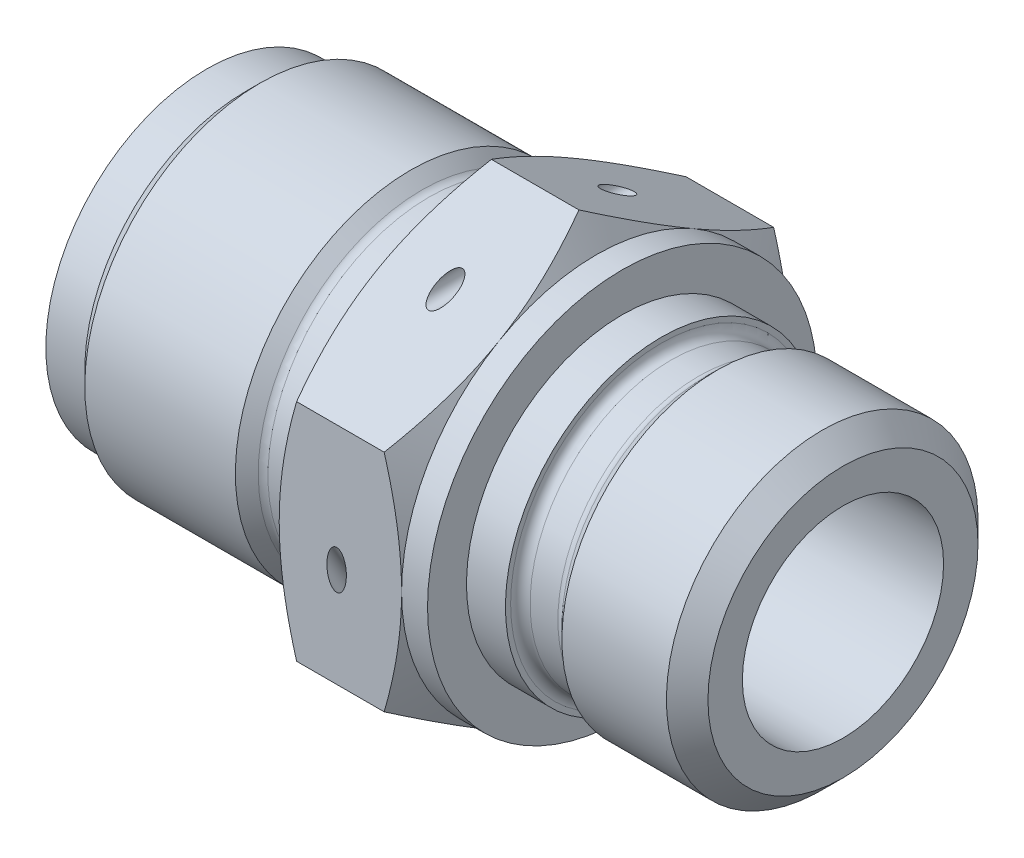
from build123d import *

# Parameters (mm, degrees)
SKETCH_2_OUTSIDE_W       = 57.368
SKETCH_2_OUTSIDE_H       = 57.368
CUT_EXTRUDE_1_DEPTH      = 41.509258201
SKETCH_3_OUTSIDE_W       = 188.496
SKETCH_3_OUTSIDE_H       = 193.138
SKETCH_3_OUTSIDE_R       = 15
CUT_EXTRUDE_2_DEPTH      = 41.174618853
CUT_EXTRUDE_2_DRAFT      = -60
SKETCH_4_OUTSIDE_W       = 177.358
SKETCH_4_OUTSIDE_H       = 182
SKETCH_4_OUTSIDE_R       = 14
CUT_EXTRUDE_3_DEPTH      = 37.959437225
CUT_EXTRUDE_3_DRAFT      = -60
SKETCH_5_R               = 0.75
CUT_EXTRUDE_4_DEPTH      = 57.824290581
PATTERN_CIRCULAR_1_COUNT = 3


with BuildPart() as part:
    # Эскиз1 → Повернуть1 (revolve)
    with BuildSketch(Plane.XY):
        with BuildLine():
            Line((0, 7.75), (-19.3, 7.75))
            Line((-19.3, 7.75), (-19.3, 3))
            Line((-19.3, 3), (-52, 3))
            Line((-52, 3), (-52, 6.75))
            Line((-52, 6.75), (-51.75, 7))
            Line((-51.75, 7), (-49, 7))
            Line((-49, 7), (-49, 12.4))
            Line((-49, 12.4), (-46, 12.4))
            Line((-46, 12.4), (-44.9, 13.5))
            Line((-44.9, 13.5), (-33.3, 13.5))
            Line((-33.3, 13.5), (-32.419669914, 12.619669914))
            ThreePointArc((-32.419669914, 12.619669914), (-32.176352402, 12.457090351), (-31.889339828, 12.4))
            Line((-31.889339828, 12.4), (-29.75, 12.4))
            ThreePointArc((-29.75, 12.4), (-29.219669914, 12.619669914), (-29, 13.15))
            Line((-29, 13.15), (-29, 20))
            Line((-29, 20), (-19, 20))
            Line((-19, 20), (-19, 15))
            Line((-19, 15), (-17, 15))
            Line((-17, 15), (-17, 12))
            Line((-17, 12), (-14, 12))
            Line((-14, 12), (-14, 11.6))
            ThreePointArc((-14, 11.6), (-13.780330086, 11.069669914), (-13.25, 10.85))
            Line((-13.25, 10.85), (-11.110660172, 10.85))
            ThreePointArc((-11.110660172, 10.85), (-10.823647598, 10.907090351), (-10.580330086, 11.069669914))
            Line((-10.580330086, 11.069669914), (-9.65, 12))
            Line((-9.65, 12), (-1.6, 12))
            Line((-1.6, 12), (0, 10.4))
            Line((0, 10.4), (0, 7.75))
        make_face()
    revolve(axis=Axis((0, 0, 0), (-1, 0, 0)))

    # Эскиз2 outside → Вырез-Вытянуть1 (cut, through all)
    with BuildSketch(Plane.ZY.offset(29)):
        Rectangle(SKETCH_2_OUTSIDE_W, SKETCH_2_OUTSIDE_H)
        Polygon((0, 17.320508076), (-15, 8.660254038), (-15, -8.660254038), (0, -17.320508076), (15, -8.660254038), (15, 8.660254038), align=None, mode=Mode.SUBTRACT)
    extrude(amount=-CUT_EXTRUDE_1_DEPTH, mode=Mode.SUBTRACT)


with BuildPart() as cut_extrude_2_tool:
    # Эскиз3 outside → Вырез-Вытянуть2 (with draft: the straight prism first)
    with BuildSketch(Plane(origin=(-19, 0, 0), x_dir=(0, 0, -1), z_dir=(1, 0, 0))):
        Rectangle(SKETCH_3_OUTSIDE_W, SKETCH_3_OUTSIDE_H)
        with Locations(Location((0, 0, 0), (0, 0, 90))):
            Circle(SKETCH_3_OUTSIDE_R, mode=Mode.SUBTRACT)
    extrude(amount=-CUT_EXTRUDE_2_DEPTH)
    # Вырез-Вытянуть2: the draft: its side faces are tilted about the plane it starts from
    cut_extrude_2_sides = [cut_extrude_2_tool.faces().sort_by_distance(p)[0] for p in [
        (-39.587309427, -96.569, 0),
        (-39.587309427, 0, -94.248),
        (-39.587309427, 96.569, 0),
        (-39.587309427, 0, 94.248),
        (-39.587309427, -15, 0),
    ]]
    draft(cut_extrude_2_sides, Plane(origin=(-19, 0, 0), x_dir=(0, 0, -1), z_dir=(1, 0, 0)), CUT_EXTRUDE_2_DRAFT)


with BuildPart() as part_1:
    add(part.part)

    # Вырез-Вытянуть2: cut by cut_extrude_2_tool
    add(cut_extrude_2_tool.part, mode=Mode.SUBTRACT)


with BuildPart() as cut_extrude_3_tool:
    # Эскиз4 outside → Вырез-Вытянуть3 (with draft: the straight prism first)
    with BuildSketch(Plane.ZY.offset(29)):
        Rectangle(SKETCH_4_OUTSIDE_W, SKETCH_4_OUTSIDE_H)
        Circle(SKETCH_4_OUTSIDE_R, mode=Mode.SUBTRACT)
    extrude(amount=-CUT_EXTRUDE_3_DEPTH)
    # Вырез-Вытянуть3: the draft: its side faces are tilted about the plane it starts from
    cut_extrude_3_sides = [cut_extrude_3_tool.faces().sort_by_distance(p)[0] for p in [
        (-10.020281387, -91, 0),
        (-10.020281387, 0, 88.679),
        (-10.020281387, 91, 0),
        (-10.020281387, 0, -88.679),
        (-10.020281387, 0, -14),
    ]]
    draft(cut_extrude_3_sides, Plane.ZY.offset(29), CUT_EXTRUDE_3_DRAFT)


with BuildPart() as part_2:
    add(part_1.part)

    # Вырез-Вытянуть3: cut by cut_extrude_3_tool
    add(cut_extrude_3_tool.part, mode=Mode.SUBTRACT)

    # Эскиз5 → Вырез-Вытянуть4 (cut, symmetric)
    with BuildSketch(Plane.XY):
        with Locations(Location((-24, 13.5, 0), (0, 0, 270))):
            Circle(SKETCH_5_R)
    cut_extrude_4 = extrude(amount=CUT_EXTRUDE_4_DEPTH, both=True, mode=Mode.SUBTRACT)

    # Круговой массив1: Вырез-Вытянуть4 ×3 about axis
    pattern_circular_1_axis = Axis((0, 0, 0), (1, 0, 0))
    for i in range(1, PATTERN_CIRCULAR_1_COUNT):
        add(cut_extrude_4.rotate(pattern_circular_1_axis, i * 360 / PATTERN_CIRCULAR_1_COUNT), mode=Mode.SUBTRACT)


solid = part_2.part
